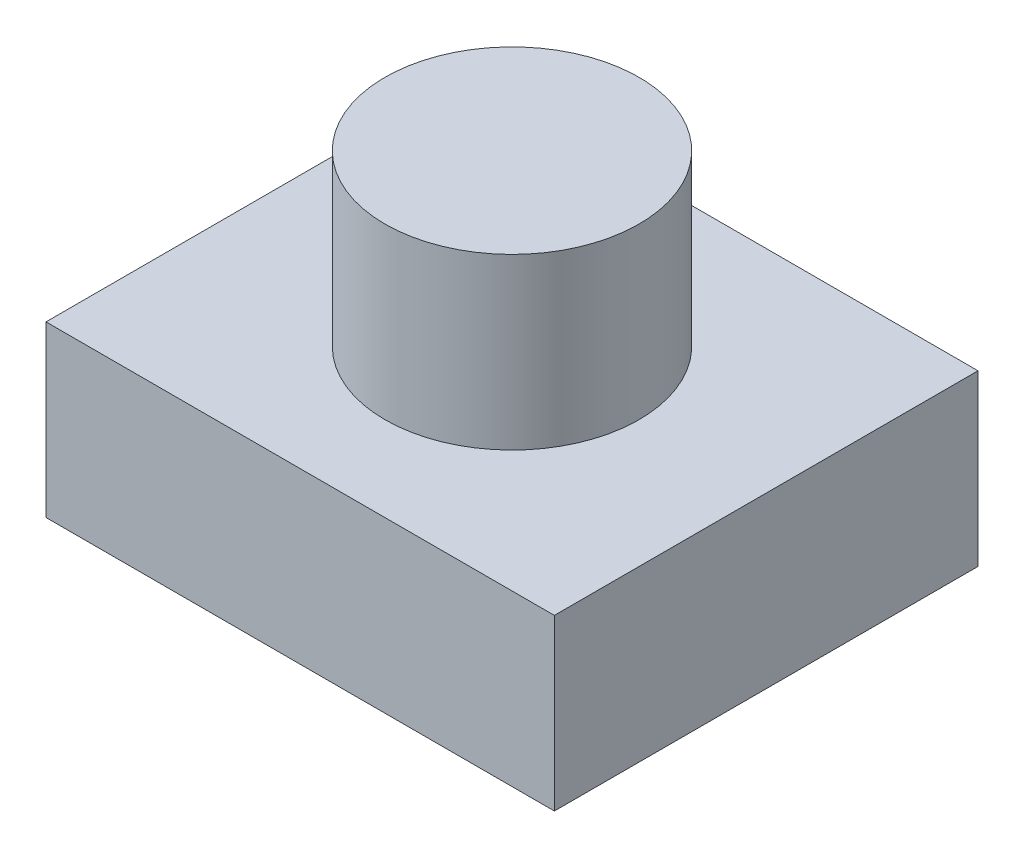
from build123d import *

# Parameters (mm, degrees)
SKETCH_1_W      = 60
SKETCH_1_H      = 50
EXTRUDE_1_DEPTH = 20
SKETCH_3_R      = 15
EXTRUDE_2_DEPTH = 20


with BuildPart() as part:
    # 스케치1 → 보스-돌출1 (new body)
    with BuildSketch(Plane(origin=(0, 0, 0), x_dir=(1, 0, 0), z_dir=(0, 1, 0))):
        with Locations((-20.544541192, 11.774614869)):
            Rectangle(SKETCH_1_W, SKETCH_1_H)
    extrude(amount=EXTRUDE_1_DEPTH)

    # 스케치3 → 보스-돌출2 (add)
    with BuildSketch(Plane(origin=(0, 20, 0), x_dir=(1, 0, 0), z_dir=(0, 1, 0))):
        with Locations(Location((-20.544541192, 11.774614869, 0), (0, 0, 270))):
            Circle(SKETCH_3_R)
    extrude(amount=EXTRUDE_2_DEPTH)


solid = part.part
